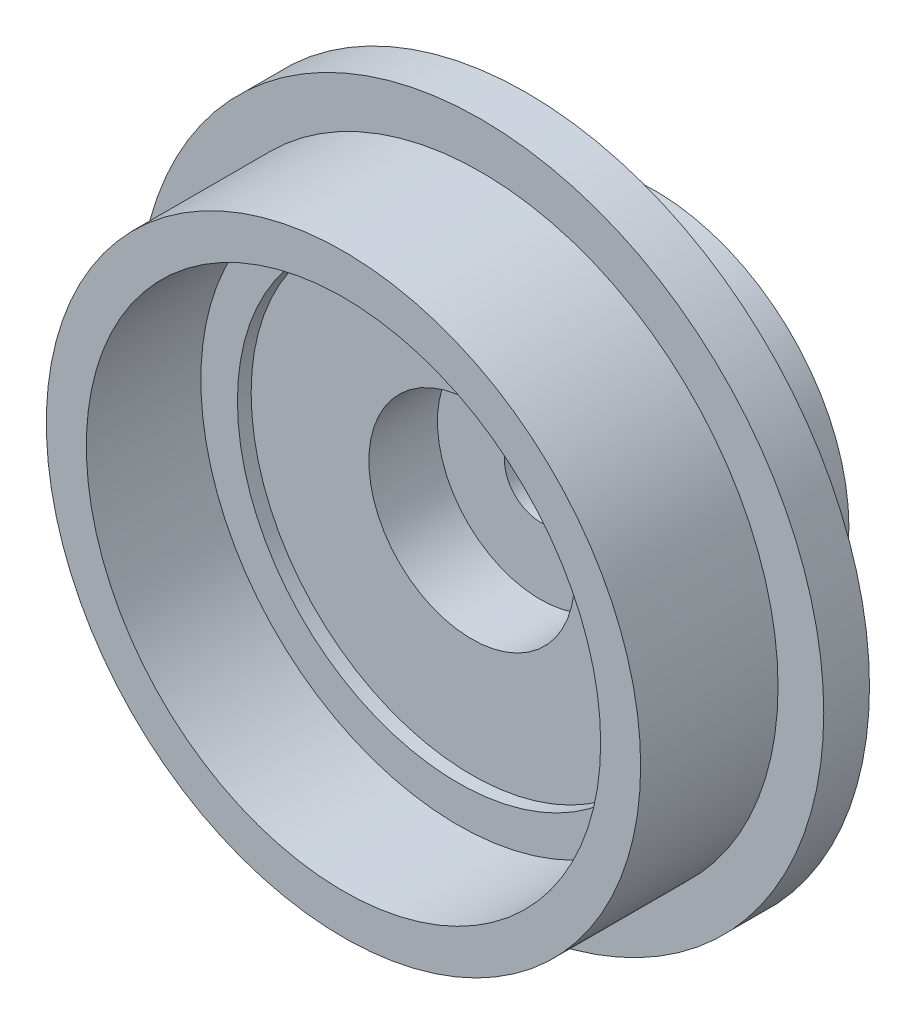
from build123d import *

# Parameters (mm, degrees)
SKETCH2_R          = 1.9939
CUT_EXTRUDE1_DEPTH = 29.792891484
SKETCH3_R          = 5.715
CUT_EXTRUDE2_DEPTH = 3.81


with BuildPart() as part:
    # Sketch1 → Revolve1 (revolve)
    with BuildSketch(Plane(origin=(0, 0, 0), x_dir=(0, 0, -1), z_dir=(1, 0, 0)), mode=Mode.PRIVATE) as revolve1_sk:
        Polygon((17.2847, 0), (7.1247, 0), (7.1247, 12.2555), (6.3627, 12.2555), (6.3627, 14.2875), (0, 14.2875), (0, 16.51), (7.6327, 16.51), (7.6327, 19.05), (10.1727, 19.05), (10.1727, 10.795), (17.2847, 10.795), align=None)
    revolve(revolve1_sk.sketch.rotate(Axis((0, 0, 32.351737074), (0, 0, -1)), 90), axis=Axis((0, 0, 32.351737074), (0, 0, -1)))

    # Sketch2 → Cut-Extrude1 (cut, through all)
    with BuildSketch(Plane.XY.offset(-7.1247)):
        Circle(SKETCH2_R)
    extrude(amount=-CUT_EXTRUDE1_DEPTH, mode=Mode.SUBTRACT)

    # Sketch3 → Cut-Extrude2 (cut)
    with BuildSketch(Plane.XY.offset(-7.1247)):
        Circle(SKETCH3_R)
    extrude(amount=-CUT_EXTRUDE2_DEPTH, mode=Mode.SUBTRACT)


solid = part.part
